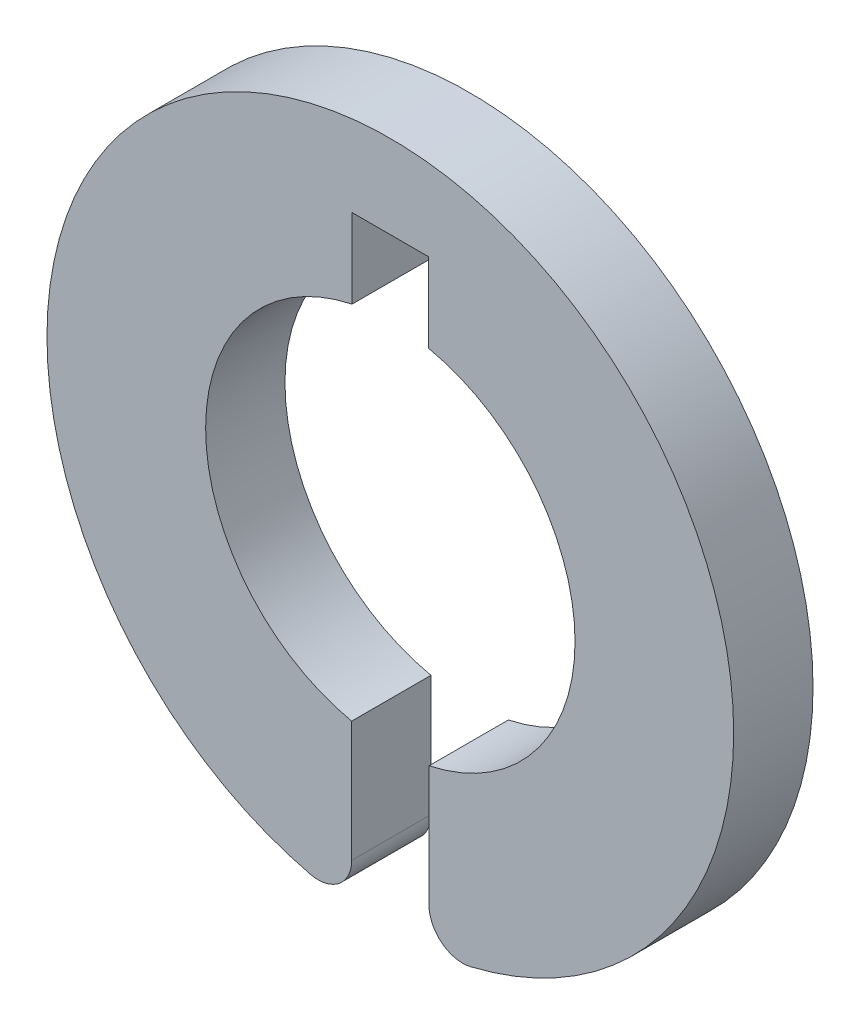
from build123d import *

# Parameters (mm, degrees)
EXTRUDE_1_DEPTH = 3
FILLET_1_R      = 1.27


with BuildPart() as part:
    # 스케치1 → 보스-돌출1 (new body)
    with BuildSketch(Plane.XY):
        with BuildLine():
            Line((-1.4475, 9.833371697), (1.4475, 9.833371697))
            Line((1.4475, 9.833371697), (1.4475, 6.833371697))
            ThreePointArc((1.4475, 6.833371697), (6.984995791, 0.007668208), (1.4625, -6.830177066))
            Line((1.4625, -6.830177066), (1.4625, -12.902376477))
            ThreePointArc((1.4625, -12.902376477), (0, 12.985), (-1.4625, -12.902376477))
            Line((-1.4625, -12.902376477), (-1.4625, -6.830177066))
            ThreePointArc((-1.4625, -6.830177066), (-6.984995791, 0.007668208), (-1.4475, 6.833371697))
            Line((-1.4475, 6.833371697), (-1.4475, 9.833371697))
        make_face()
    extrude(amount=EXTRUDE_1_DEPTH)

    # 필렛1
    fillet_1_edges = [part.edges().sort_by_distance(p)[0] for p in [
        (-1.4625, -12.902376477, 1.5),
        (1.4625, -12.902376477, 1.5),
    ]]
    fillet(fillet_1_edges, radius=FILLET_1_R)


solid = part.part
